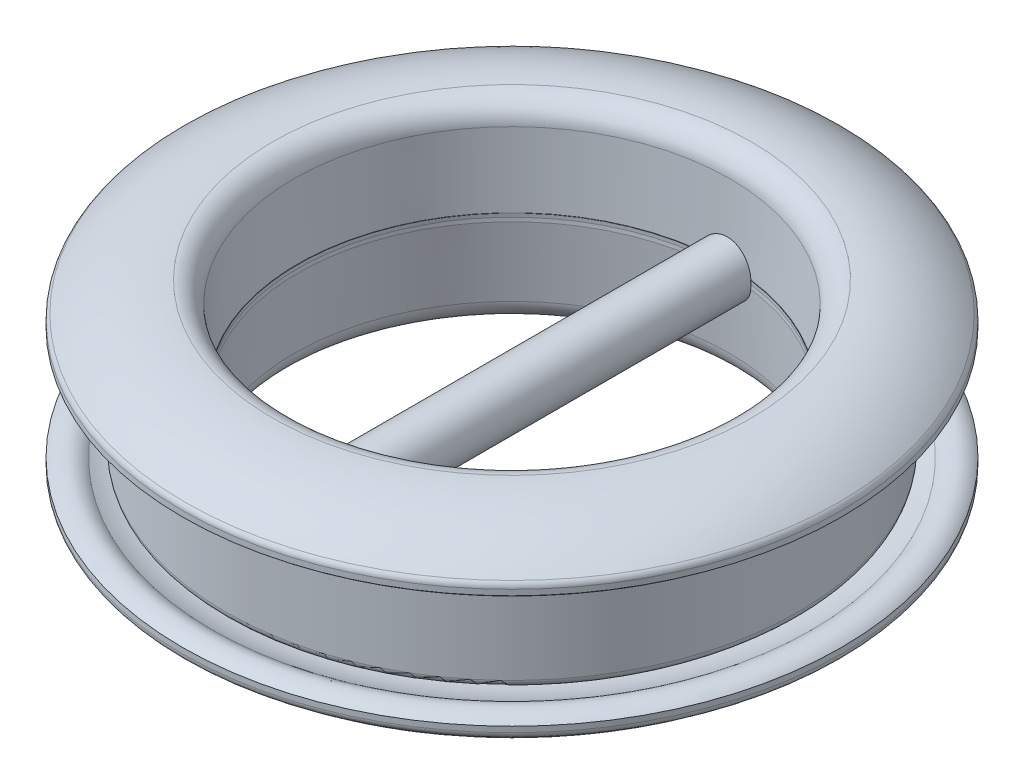
from build123d import *

# Parameters (mm, degrees)
DRAFT1_ANGLE                    = 3
FILLET3_R                       = 3.81
FILLET4_R                       = 1.27
FILLET5_R                       = 1.27
BOSS_EXTRUDE1_REACH             = 86.285
SKETCH4_R                       = 4.481324099
BOSS_EXTRUDE1_DIRECTION_2_REACH = 86.285


with BuildPart() as part:
    # Sketch1 → Revolve1 (revolve)
    with BuildSketch(Plane.XY, mode=Mode.PRIVATE) as revolve1_sk:
        with BuildLine():
            Line((36.83, 1.778), (36.83, -14.732))
            Line((36.83, -14.732), (48.26, -14.732))
            Line((48.26, -14.732), (48.26, -4.826))
            Line((48.26, -4.826), (43.045922533, -4.826))
            ThreePointArc((43.045922533, -4.826), (40.386, -3.81), (43.045922533, -2.794))
            ThreePointArc((43.045922533, -2.794), (46.869009258, -3.244676951), (50.4825, -4.572))
            ThreePointArc((50.4825, -4.572), (53.0225, -5.542193669), (55.5625, -4.572))
            Line((55.5625, -4.572), (55.5625, -3.048))
            ThreePointArc((55.5625, -3.048), (46.778685012, 1.625767482), (36.83, 1.778))
        make_face()
    revolve(revolve1_sk.sketch.rotate(Axis((0, 0, 0), (0, 1, 0)), 90), axis=Axis((0, 0, 0), (0, 1, 0)))

    # Draft1
    draft1_faces = [part.faces().sort_by_distance(p)[0] for p in [
        (0, -6.477, 36.83),
    ]]
    draft(draft1_faces, Plane.ZX, DRAFT1_ANGLE)

    # Fillet3
    fillet3_edges = [part.edges().sort_by_distance(p)[0] for p in [
        (0, 1.799010579, 36.924282149),
    ]]
    fillet(fillet3_edges, radius=FILLET3_R)

    # Fillet4
    fillet4_edges = [part.edges().sort_by_distance(p)[0] for p in [
        (0, -3.048, 55.5625),
    ]]
    fillet(fillet4_edges, radius=FILLET4_R)

    # Fillet5
    fillet5_edges = [part.edges().sort_by_distance(p)[0] for p in [
        (0, -4.826, 48.26),
    ]]
    fillet(fillet5_edges, radius=FILLET5_R)


with BuildPart() as body_2:
    # Mirror4: mirrored copy
    add(part.part.mirror(Plane.ZX.offset(-14.097)))

    # Combine1: union part
    add(part.part)

    # Sketch4 → Boss-Extrude1 (add, up to next)
    with BuildSketch(Plane.XY, mode=Mode.PRIVATE) as boss_extrude1_sk1:
        with Locations((0, -14.097)):
            Circle(SKETCH4_R)
    boss_extrude1_tool1 = extrude(boss_extrude1_sk1.sketch, amount=BOSS_EXTRUDE1_REACH, mode=Mode.PRIVATE) - body_2.part
    add(boss_extrude1_tool1.solids().sort_by_distance((0, -14.097, 0))[0])

    # Sketch4 → Boss-Extrude1 direction 2 (add, up to next)
    with BuildSketch(Plane.XY, mode=Mode.PRIVATE) as boss_extrude1_direction_2_sk1:
        with Locations((0, -14.097)):
            Circle(SKETCH4_R)
    boss_extrude1_direction_2_tool1 = extrude(boss_extrude1_direction_2_sk1.sketch, amount=-BOSS_EXTRUDE1_DIRECTION_2_REACH, mode=Mode.PRIVATE) - body_2.part
    add(boss_extrude1_direction_2_tool1.solids().sort_by_distance((0, -14.097, 0))[0])


solid = body_2.part
